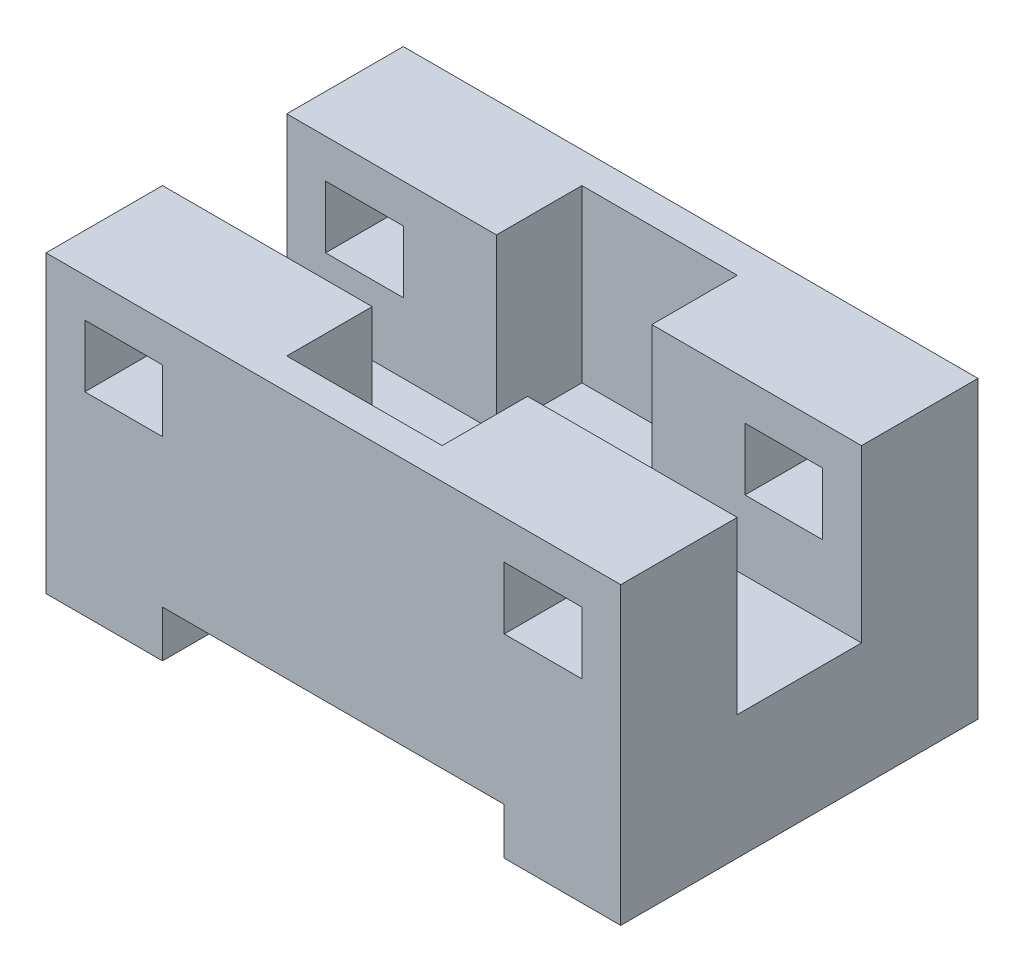
from build123d import *

# Parameters (mm, degrees)
SALIENTE_EXTRUIR1_DEPTH = 46
CORTAR_EXTRUIR1_DEPTH   = 22
CROQUIS3_W              = 10
CROQUIS3_H              = 8
CORTAR_EXTRUIR2_DEPTH   = 68.149087857


with BuildPart() as part:
    # Croquis1 → Saliente-Extruir1 (new body)
    with BuildSketch(Plane.XY):
        Polygon((22, -6), (37, -6), (37, 32), (-37, 32), (-37, -6), (-22, -6), (-22, 0), (22, 0), align=None)
    extrude(amount=-SALIENTE_EXTRUIR1_DEPTH)

    # Croquis2 → Cortar-Extruir1 (cut)
    with BuildSketch(Plane(origin=(0, 32, 0), x_dir=(1, 0, 0), z_dir=(0, 1, 0))):
        Polygon((10, 4), (10, 15), (37, 15), (37, 31), (10, 31), (10, 42), (-10, 42), (-10, 31), (-37, 31), (-37, 15), (-10, 15), (-10, 4), align=None)
    extrude(amount=-CORTAR_EXTRUIR1_DEPTH, mode=Mode.SUBTRACT)

    # Croquis3 → Cortar-Extruir2 (cut, through all)
    with BuildSketch(Plane.XY):
        with Locations((-27, 23)):
            Rectangle(CROQUIS3_W, CROQUIS3_H)
        with Locations((27, 23)):
            Rectangle(CROQUIS3_W, CROQUIS3_H)
    extrude(amount=-CORTAR_EXTRUIR2_DEPTH, mode=Mode.SUBTRACT)


solid = part.part
